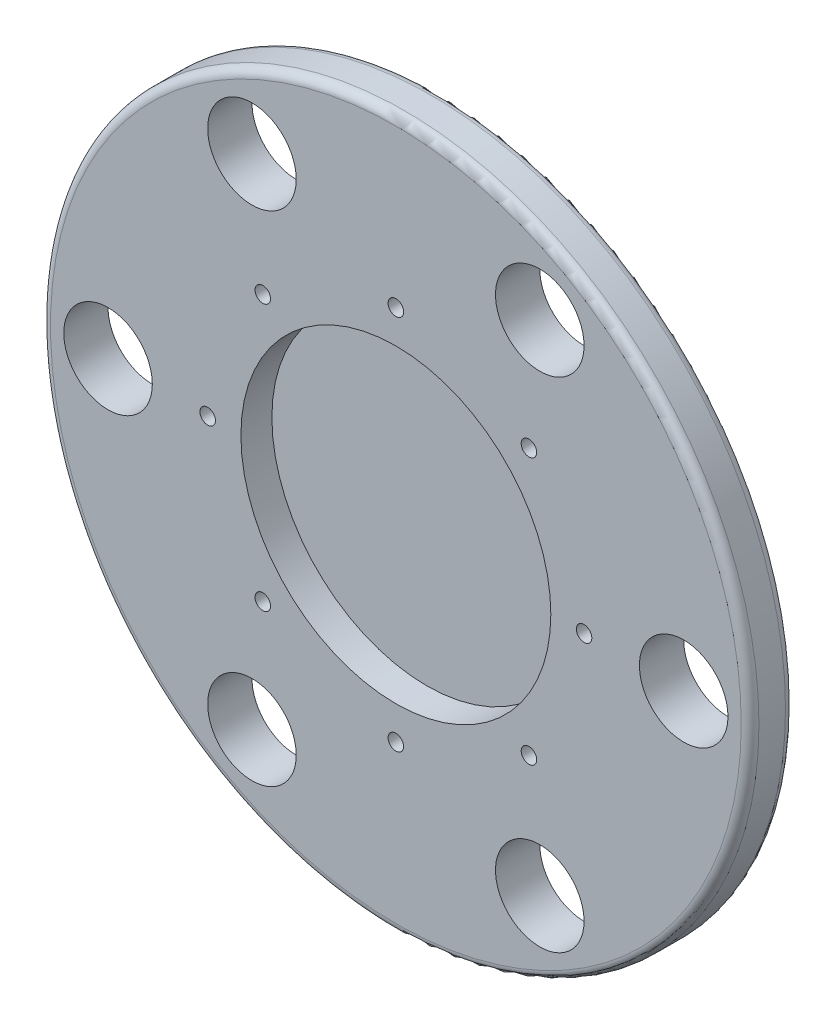
from build123d import *

# Parameters (mm, degrees)
SKETCH_3_R          = 80
EXTRUDE_1_DEPTH     = 10
SKETCH_4_R          = 35
CUT_EXTRUDE_1_DEPTH = 7
SKETCH_5_R          = 10
CUT_EXTRUDE_2_DEPTH = 10
SKETCH_6_R          = 1.75
CUT_EXTRUDE_3_DEPTH = 10
FILLET_1_R          = 2


with BuildPart() as part:
    # 草图3 → 凸台-拉伸1 (new body)
    with BuildSketch(Plane.XY):
        Circle(SKETCH_3_R)
    extrude(amount=-EXTRUDE_1_DEPTH)

    # 草图4 → 切除-拉伸1 (cut)
    with BuildSketch(Plane.XY):
        Circle(SKETCH_4_R)
    extrude(amount=-CUT_EXTRUDE_1_DEPTH, mode=Mode.SUBTRACT)

    # 草图5 → 切除-拉伸2 (cut)
    with BuildSketch(Plane.XY):
        with Locations((-65, 0)):
            Circle(SKETCH_5_R)
        with Locations((-32.4995, 56.292517271)):
            Circle(SKETCH_5_R)
        with Locations((32.5015, 56.292517271)):
            Circle(SKETCH_5_R)
        with Locations((65.002, 0)):
            Circle(SKETCH_5_R)
        with Locations((32.5015, -56.292517271)):
            Circle(SKETCH_5_R)
        with Locations((-32.4995, -56.292517271)):
            Circle(SKETCH_5_R)
    extrude(amount=-CUT_EXTRUDE_2_DEPTH, mode=Mode.SUBTRACT)

    # 草图6 → 切除-拉伸3 (cut)
    with BuildSketch(Plane.XY):
        with Locations((-42.5, 0)):
            Circle(SKETCH_6_R)
        with Locations((-30.0520382, 30.0520382)):
            Circle(SKETCH_6_R)
        with Locations((0, 42.5)):
            Circle(SKETCH_6_R)
        with Locations((30.0520382, 30.0520382)):
            Circle(SKETCH_6_R)
        with Locations((42.5, 0)):
            Circle(SKETCH_6_R)
        with Locations((30.0520382, -30.0520382)):
            Circle(SKETCH_6_R)
        with Locations((0, -42.5)):
            Circle(SKETCH_6_R)
        with Locations((-30.0520382, -30.0520382)):
            Circle(SKETCH_6_R)
    extrude(amount=-CUT_EXTRUDE_3_DEPTH, mode=Mode.SUBTRACT)

    # 圆角1
    fillet_1_edges = [part.edges().sort_by_distance(p)[0] for p in [
        (-80, 0, 0),
        (-80, 0, -10),
    ]]
    fillet(fillet_1_edges, radius=FILLET_1_R)


solid = part.part
